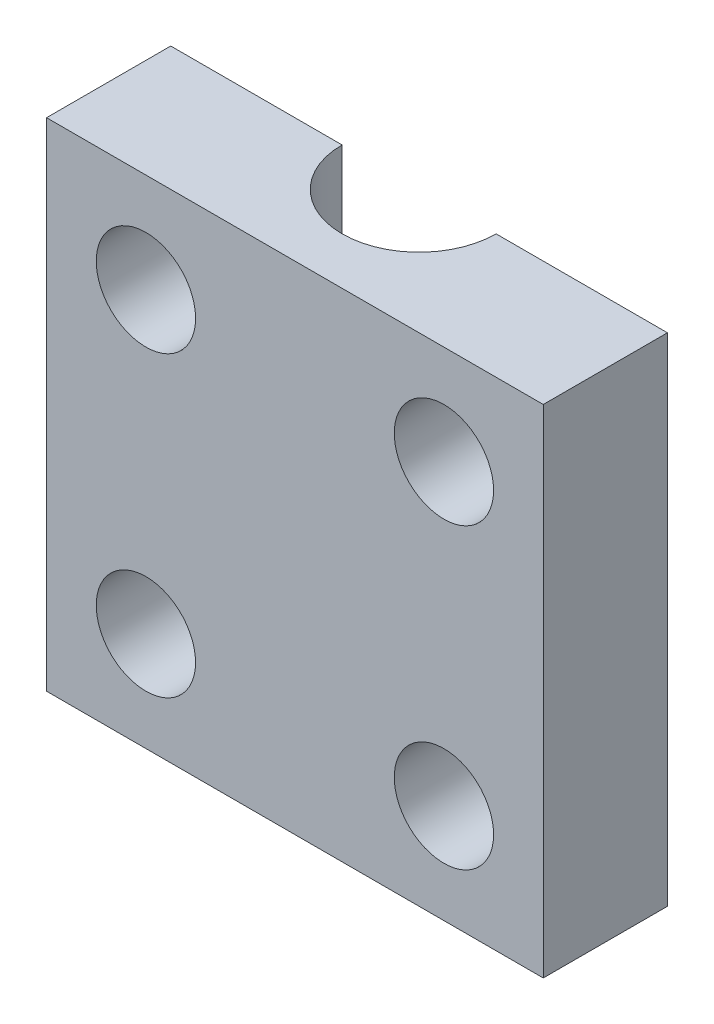
from build123d import *

# Parameters (mm, degrees)
SKETCH1_W           = 20
SKETCH1_H           = 20
BOSS_EXTRUDE1_DEPTH = 5
CUT_EXTRUDE1_REACH  = 24.913
SKETCH2_R           = 3.1
CUT_EXTRUDE2_REACH  = 17
SKETCH3_R           = 2


with BuildPart() as part:
    # Sketch1 → Boss-Extrude1 (new body)
    with BuildSketch(Plane.XY):
        Rectangle(SKETCH1_W, SKETCH1_H)
    extrude(amount=BOSS_EXTRUDE1_DEPTH)

    # Sketch2 → Cut-Extrude1 (cut, up to next)
    with BuildSketch(Plane(origin=(0, 10, 0), x_dir=(1, 0, 0), z_dir=(0, 1, 0)), mode=Mode.PRIVATE) as cut_extrude1_sk1:
        Circle(SKETCH2_R)
    cut_extrude1_tool1 = extrude(cut_extrude1_sk1.sketch, amount=-CUT_EXTRUDE1_REACH, mode=Mode.PRIVATE) & part.part
    add(cut_extrude1_tool1.solids().sort_by_distance((0, 10, 0))[0], mode=Mode.SUBTRACT)

    # Sketch3 → Cut-Extrude2 (cut, up to next)
    with BuildSketch(Plane.XY.offset(5), mode=Mode.PRIVATE) as cut_extrude2_sk1:
        with Locations((-6, 6)):
            Circle(SKETCH3_R)
    cut_extrude2_tool1 = extrude(cut_extrude2_sk1.sketch, amount=-CUT_EXTRUDE2_REACH, mode=Mode.PRIVATE) & part.part
    # Sketch3 → Cut-Extrude2 (cut, up to next)
    with BuildSketch(Plane.XY.offset(5), mode=Mode.PRIVATE) as cut_extrude2_sk2:
        with Locations((-6, -6)):
            Circle(SKETCH3_R)
    cut_extrude2_tool2 = extrude(cut_extrude2_sk2.sketch, amount=-CUT_EXTRUDE2_REACH, mode=Mode.PRIVATE) & part.part
    # Sketch3 → Cut-Extrude2 (cut, up to next)
    with BuildSketch(Plane.XY.offset(5), mode=Mode.PRIVATE) as cut_extrude2_sk3:
        with Locations((6, -6)):
            Circle(SKETCH3_R)
    cut_extrude2_tool3 = extrude(cut_extrude2_sk3.sketch, amount=-CUT_EXTRUDE2_REACH, mode=Mode.PRIVATE) & part.part
    # Sketch3 → Cut-Extrude2 (cut, up to next)
    with BuildSketch(Plane.XY.offset(5), mode=Mode.PRIVATE) as cut_extrude2_sk4:
        with Locations((6, 6)):
            Circle(SKETCH3_R)
    cut_extrude2_tool4 = extrude(cut_extrude2_sk4.sketch, amount=-CUT_EXTRUDE2_REACH, mode=Mode.PRIVATE) & part.part
    add(cut_extrude2_tool1.solids().sort_by_distance((-6, 6, 5))[0], mode=Mode.SUBTRACT)
    add(cut_extrude2_tool2.solids().sort_by_distance((-6, -6, 5))[0], mode=Mode.SUBTRACT)
    add(cut_extrude2_tool3.solids().sort_by_distance((6, -6, 5))[0], mode=Mode.SUBTRACT)
    add(cut_extrude2_tool4.solids().sort_by_distance((6, 6, 5))[0], mode=Mode.SUBTRACT)


solid = part.part
